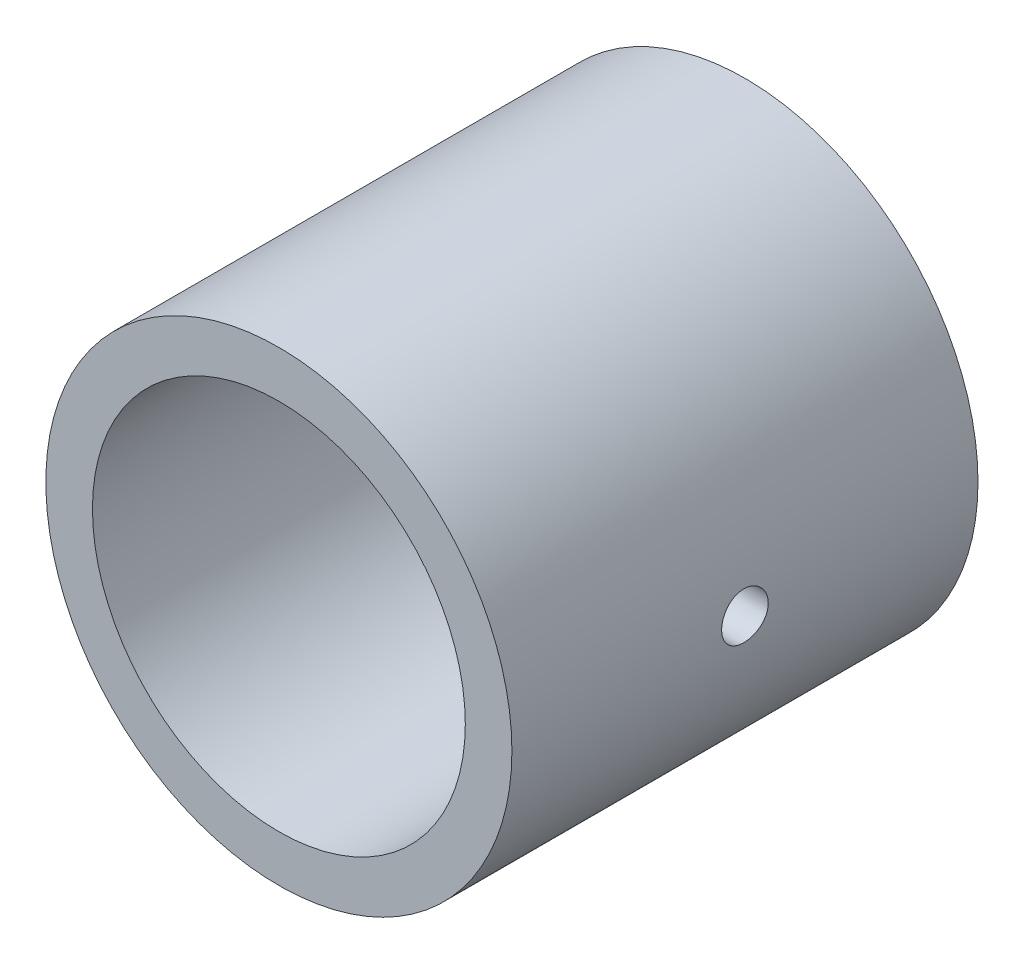
from build123d import *

# Parameters (mm, degrees)
SKETCH1_R               = 25
BOSS_EXTRUDE1_DEPTH     = 50
SKETCH2_R               = 20
CUT_EXTRUDE1_DEPTH      = 50
CUT_EXTRUDE2_DEPTH      = 50
CUT_EXTRUDE2_DEPTH_BACK = 50
SKETCH3_R               = 2.5


with BuildPart() as part:
    # Sketch1 → Boss-Extrude1 (new body)
    with BuildSketch(Plane.XY):
        Circle(SKETCH1_R)
    extrude(amount=BOSS_EXTRUDE1_DEPTH)

    # Sketch2 → Cut-Extrude1 (cut)
    with BuildSketch(Plane.XY.offset(50)):
        Circle(SKETCH2_R)
    extrude(amount=-CUT_EXTRUDE1_DEPTH, mode=Mode.SUBTRACT)

    # Sketch3 → Cut-Extrude2 (cut, two sides: drawn at the far end of the back side and taken through both)
    with BuildSketch(Plane(origin=(0, 0, 0), x_dir=(0, 0, -1), z_dir=(1, 0, 0)).offset(-CUT_EXTRUDE2_DEPTH_BACK)):
        with Locations((-25, 0)):
            Circle(SKETCH3_R)
    extrude(amount=CUT_EXTRUDE2_DEPTH + CUT_EXTRUDE2_DEPTH_BACK, mode=Mode.SUBTRACT)


solid = part.part
